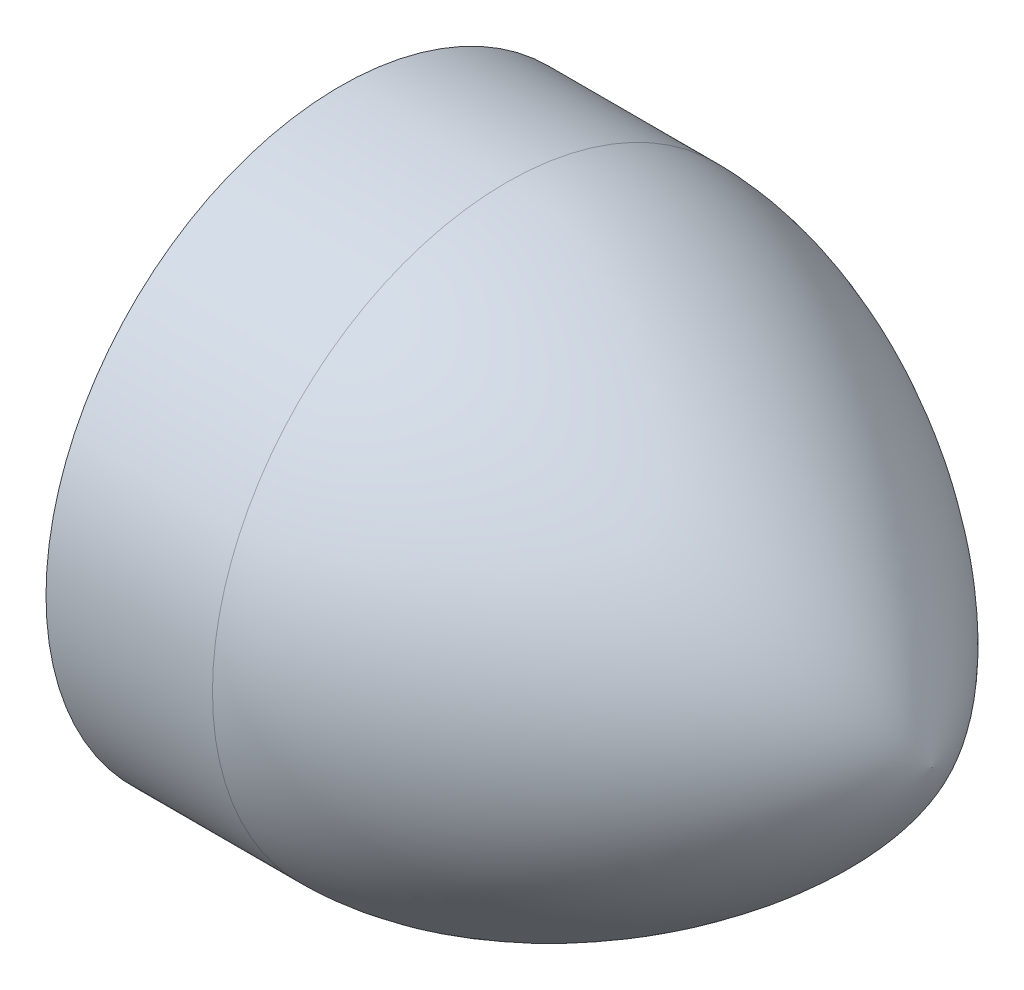
from build123d import *


with BuildPart() as part:
    # Sketch1 → Revolve1 (revolve)
    with BuildSketch(Plane.XY, mode=Mode.PRIVATE) as revolve1_sk:
        with BuildLine():
            Line((0, 0), (0, 10.12047406))
            Line((0, 10.12047406), (5.729163504, 10.12047406))
            add(Edge.make_bspline(
                [(5.729163504, 10.12047406), (11.657541744, 10.144836097), (19.425538575, 4.187675631), (20.354222937, 0)],
                knots=[0, 0, 0, 0, 1, 1, 1, 1], degree=3))
            Line((20.354222937, 0), (0, 0))
        make_face()
    revolve(revolve1_sk.sketch.rotate(Axis((0, 0, 0), (1, 0, 0)), 90), axis=Axis((0, 0, 0), (1, 0, 0)))


solid = part.part
